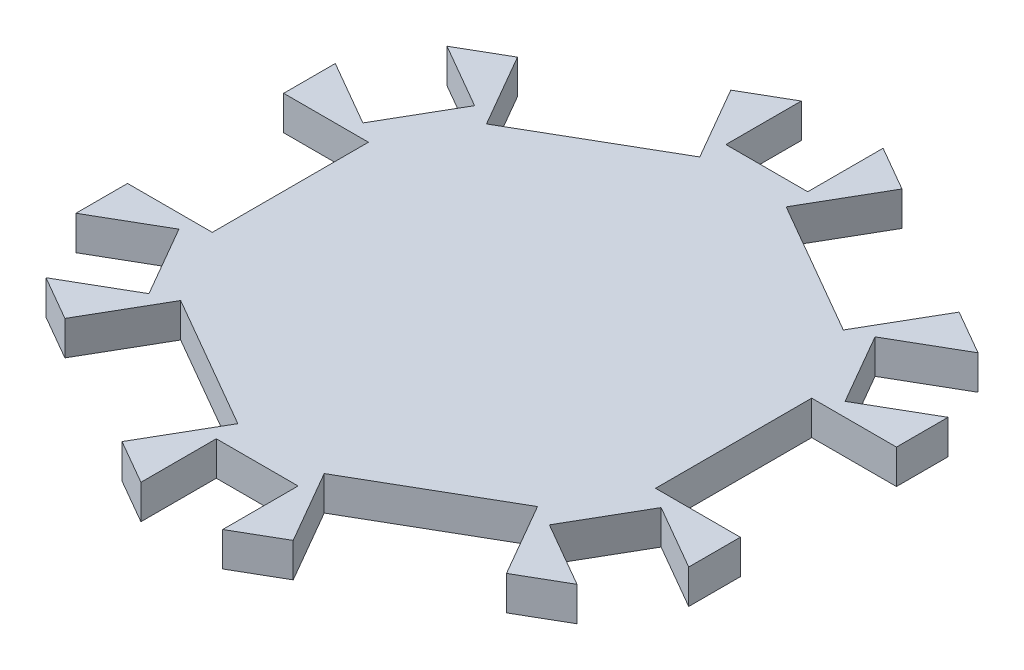
from build123d import *

# Parameters (mm, degrees)
BOSS_EXTRUDE3_DEPTH = 6.9
CUT_EXTRUDE1_DEPTH  = 10


with BuildPart() as part:
    # Sketch10 → Boss-Extrude3 (new body)
    with BuildSketch(Plane(origin=(0, 0, 0), x_dir=(1, 0, 0), z_dir=(0, 1, 0))):
        Polygon((-44.545662223, 45.655350227), (-61.811524227, 35.686900152), (-61.811524227, 15.75), (-44.711524227, 15.75), (-44.711524227, -15.75), (-61.811524227, -15.75), (-61.811524227, -35.686900152), (-44.545662223, -45.655350227), (-35.995662223, -30.846315823), (-8.715862004, -46.596315823), (-17.265862004, -61.405350227), (0, -71.373800303), (17.265862004, -61.405350227), (8.715862004, -46.596315823), (35.995662223, -30.846315823), (44.545662223, -45.655350227), (61.811524227, -35.686900152), (61.811524227, -15.75), (44.711524227, -15.75), (44.711524227, 15.75), (61.811524227, 15.75), (61.811524227, 35.686900152), (44.545662223, 45.655350227), (35.995662223, 30.846315823), (8.715862004, 46.596315823), (17.265862004, 61.405350227), (0, 71.373800303), (-17.265862004, 61.405350227), (-8.715862004, 46.596315823), (-35.995662223, 30.846315823), align=None)
    extrude(amount=BOSS_EXTRUDE3_DEPTH)

    # Sketch11 → Cut-Extrude1 (cut)
    with BuildSketch(Plane(origin=(0, 6.9, 0), x_dir=(1, 0, 0), z_dir=(0, 1, 0))):
        Polygon((-40.392179181, 32.846714965), (-53.561524227, 40.450039872), (-61.811524227, 35.686900152), (-61.811524227, 26.16062071), (-48.642179181, 18.557295803), align=None)
        Polygon((0, 71.373800303), (-8.25, 66.610660582), (-8.25, 51.404010768), (8.25, 51.404010768), (8.25, 66.610660582), align=None)
        Polygon((61.811524227, 35.686900152), (53.561524227, 40.450039872), (40.392179181, 32.846714965), (48.642179181, 18.557295803), (61.811524227, 26.16062071), align=None)
        Polygon((61.811524227, -35.686900152), (61.811524227, -26.16062071), (48.642179181, -18.557295803), (40.392179181, -32.846714965), (53.561524227, -40.450039872), align=None)
        Polygon((-8.25, -51.404010768), (-8.25, -66.610660582), (0, -71.373800303), (8.25, -66.610660582), (8.25, -51.404010768), align=None)
        Polygon((-48.642179181, -18.557295803), (-61.811524227, -26.16062071), (-61.811524227, -35.686900152), (-53.561524227, -40.450039872), (-40.392179181, -32.846714965), align=None)
    extrude(amount=-CUT_EXTRUDE1_DEPTH, mode=Mode.SUBTRACT)


solid = part.part
